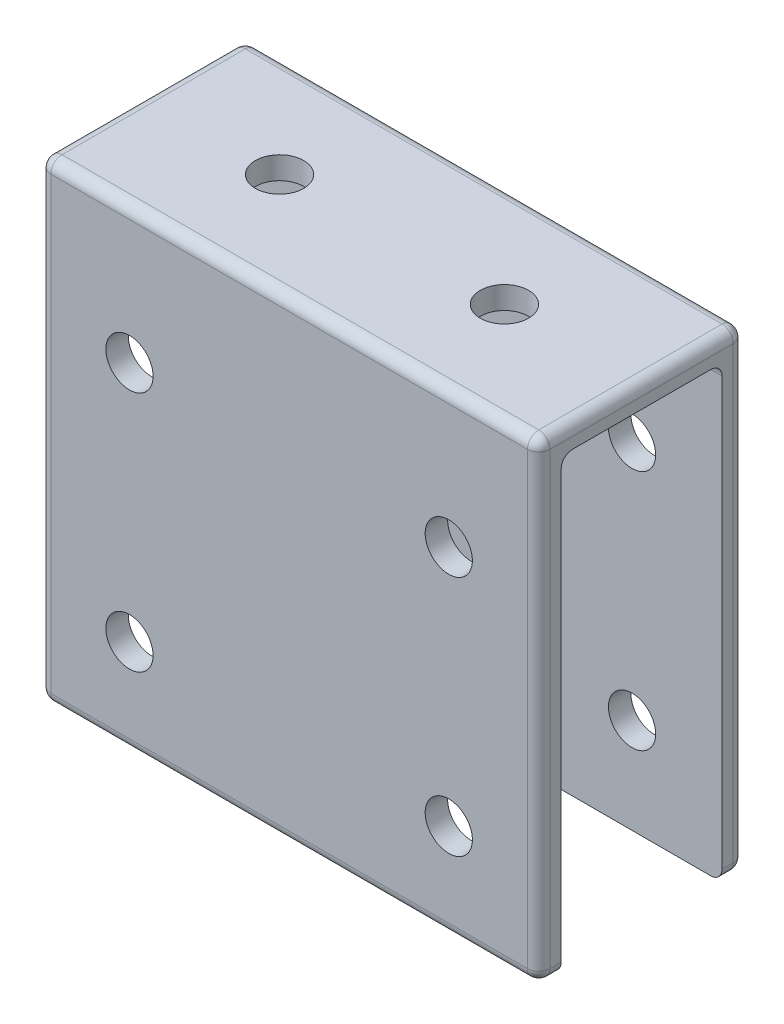
from build123d import *

# Parameters (mm, degrees)
SKETCH1_W           = 44.4
SKETCH1_H           = 40
SKETCH1_R           = 2.1
BOSS_EXTRUDE1_DEPTH = 2
SKETCH2_W           = 44.4
SKETCH2_H           = 18.3
BOSS_EXTRUDE2_DEPTH = 2
LPATTERN1_COUNT     = 2
LPATTERN1_PITCH     = 16.3
SKETCH3_R           = 2.15
CUT_EXTRUDE1_DEPTH  = 64.253853638
FILLET4_R           = 1


with BuildPart() as part:
    # Sketch1 → Boss-Extrude1 (new body)
    with BuildSketch(Plane.XY):
        with Locations((22.2, 20)):
            Rectangle(SKETCH1_W, SKETCH1_H)
        with Locations((8, 8.476902454)):
            Circle(SKETCH1_R, mode=Mode.SUBTRACT)
        with Locations((8, 29.976902454)):
            Circle(SKETCH1_R, mode=Mode.SUBTRACT)
        with Locations((36.4, 29.976902454)):
            Circle(SKETCH1_R, mode=Mode.SUBTRACT)
        with Locations((36.4, 8.476902454)):
            Circle(SKETCH1_R, mode=Mode.SUBTRACT)
    boss_extrude1 = extrude(amount=BOSS_EXTRUDE1_DEPTH)

    # Sketch2 → Boss-Extrude2 (add)
    with BuildSketch(Plane(origin=(0, 40, 0), x_dir=(1, 0, 0), z_dir=(0, 1, 0))):
        with Locations((22.2, 7.15)):
            Rectangle(SKETCH2_W, SKETCH2_H)
    extrude(amount=BOSS_EXTRUDE2_DEPTH)

    # LPattern1: Boss-Extrude1 ×2
    with Locations(*[(0, 0, -i * LPATTERN1_PITCH) for i in range(1, LPATTERN1_COUNT)]):
        add(boss_extrude1)

    # Sketch3 → Cut-Extrude1 (cut, through all)
    with BuildSketch(Plane(origin=(0, 42, 0), x_dir=(1, 0, 0), z_dir=(0, 1, 0))):
        with Locations(Location((12.2, 7.15, 0), (0, 0, 270))):
            Circle(SKETCH3_R)
        with Locations(Location((32.2, 7.15, 0), (0, 0, 270))):
            Circle(SKETCH3_R)
    extrude(amount=-CUT_EXTRUDE1_DEPTH, mode=Mode.SUBTRACT)

    # Fillet4
    fillet4_edges = [part.edges().sort_by_distance(p)[0] for p in [
        (44.4, 21, 2),
        (0, 21, -16.3),
        (44.4, 21, -16.3),
        (0, 42, -7.15),
        (22.2, 42, 2),
        (44.4, 42, -7.15),
        (22.2, 42, -16.3),
        (22.2, 40, -14.3),
        (22.2, 0, -16.3),
        (0, 0, -15.3),
        (44.4, 0, -15.3),
        (0, 21, 2),
        (22.2, 40, 0),
        (44.4, 0, 1),
        (0, 0, 1),
        (22.2, 0, 2),
    ]]
    fillet(fillet4_edges, radius=FILLET4_R)


solid = part.part
